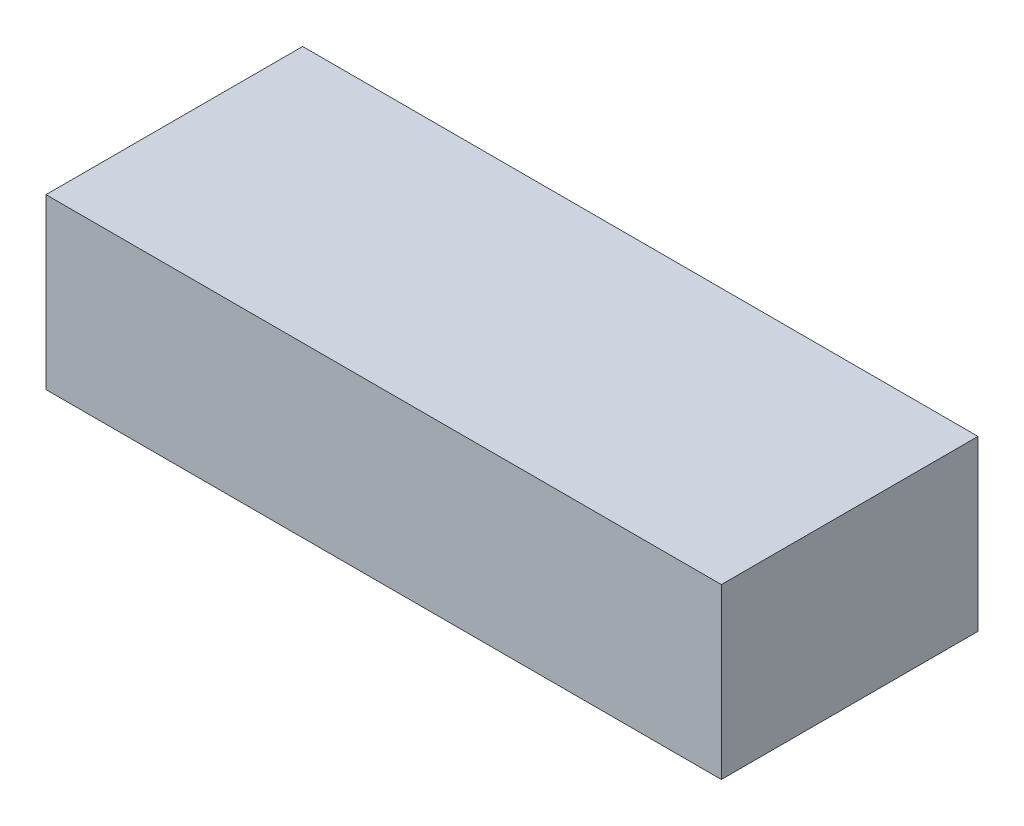
from build123d import *

# Parameters (mm, degrees)
SKETCH_1_W      = 100
SKETCH_1_H      = 38
EXTRUDE_1_DEPTH = 25


with BuildPart() as part:
    # 草图1 → 凸台-拉伸1 (new body)
    with BuildSketch(Plane(origin=(0, 0, 0), x_dir=(1, 0, 0), z_dir=(0, 1, 0))):
        with Locations((50, -19)):
            Rectangle(SKETCH_1_W, SKETCH_1_H)
    extrude(amount=EXTRUDE_1_DEPTH)


solid = part.part
